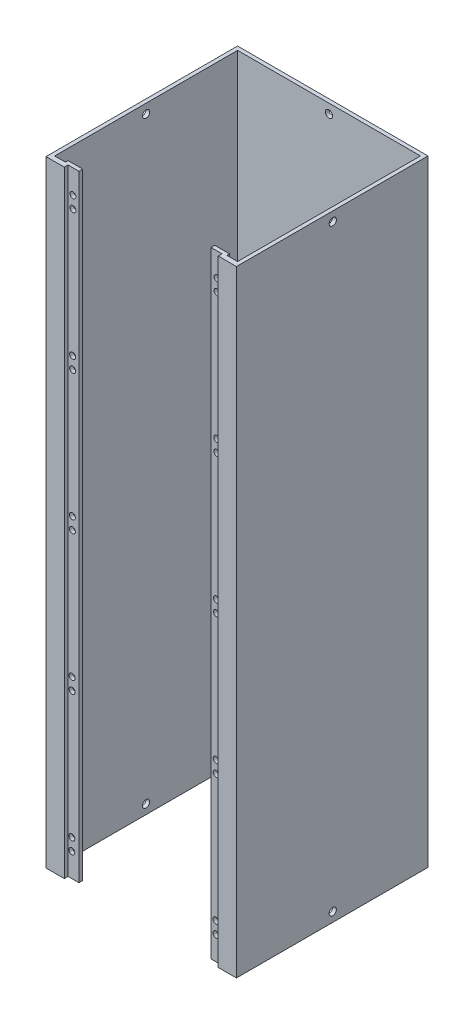
from build123d import *

# Parameters (mm, degrees)
BOSS_EXTRUDE1_DEPTH = 327.5
SKETCH2_R           = 1.6
CUT_EXTRUDE2_DEPTH  = 10
SKETCH3_R           = 1.93
CUT_EXTRUDE3_DEPTH  = 102
SKETCH4_R           = 1.93
CUT_EXTRUDE4_DEPTH  = 10


with BuildPart() as part:
    # Sketch1 → Boss-Extrude1 (new body)
    with BuildSketch(Plane(origin=(0, 0, 0), x_dir=(1, 0, 0), z_dir=(0, 1, 0))):
        Polygon((0, -0.603), (0, 101.206), (101.206, 101.206), (101.206, -0.6), (91.5, -0.6), (91.5, 1.4), (85.703, 1.4), (85.703, 3.4), (93.5, 3.4), (93.5, 2), (99.206, 2), (99.206, 99.206), (2, 99.206), (2, 2), (7.706, 2), (7.706, 3.397), (15.503, 3.397), (15.503, 1.397), (9.706, 1.397), (9.706, -0.603), align=None)
    extrude(amount=BOSS_EXTRUDE1_DEPTH)

    # Sketch2 → Cut-Extrude2 (cut)
    with BuildSketch(Plane.XY.offset(-1.397)):
        with Locations((12.303, 314.9)):
            Circle(SKETCH2_R)
        with Locations((12.303, 308.5)):
            Circle(SKETCH2_R)
        with Locations((88.903, 314.9)):
            Circle(SKETCH2_R)
        with Locations((88.903, 308.5)):
            Circle(SKETCH2_R)
        with Locations((12.15225, 240.925)):
            Circle(SKETCH2_R)
        with Locations((12.15225, 234.525)):
            Circle(SKETCH2_R)
        with Locations((88.75225, 240.925)):
            Circle(SKETCH2_R)
        with Locations((88.75225, 234.525)):
            Circle(SKETCH2_R)
        with Locations((12.0015, 166.95)):
            Circle(SKETCH2_R)
        with Locations((12.0015, 160.55)):
            Circle(SKETCH2_R)
        with Locations((88.6015, 166.95)):
            Circle(SKETCH2_R)
        with Locations((88.6015, 160.55)):
            Circle(SKETCH2_R)
        with Locations((11.85075, 92.975)):
            Circle(SKETCH2_R)
        with Locations((11.85075, 86.575)):
            Circle(SKETCH2_R)
        with Locations((88.45075, 92.975)):
            Circle(SKETCH2_R)
        with Locations((88.45075, 86.575)):
            Circle(SKETCH2_R)
        with Locations((11.7, 19)):
            Circle(SKETCH2_R)
        with Locations((11.7, 12.6)):
            Circle(SKETCH2_R)
        with Locations((88.3, 19)):
            Circle(SKETCH2_R)
        with Locations((88.3, 12.6)):
            Circle(SKETCH2_R)
    extrude(amount=-CUT_EXTRUDE2_DEPTH, mode=Mode.SUBTRACT)

    # Sketch3 → Cut-Extrude3 (cut)
    with BuildSketch(Plane(origin=(101.206, 0, 0), x_dir=(0, 0, -1), z_dir=(1, 0, 0))):
        with Locations((50.603, 322.524)):
            Circle(SKETCH3_R)
        with Locations((50.603, 4.976)):
            Circle(SKETCH3_R)
    extrude(amount=-CUT_EXTRUDE3_DEPTH, mode=Mode.SUBTRACT)

    # Sketch4 → Cut-Extrude4 (cut)
    with BuildSketch(Plane(origin=(0, 0, -101.206), x_dir=(-1, 0, 0), z_dir=(0, 0, -1))):
        with Locations((-50.603, 322.524)):
            Circle(SKETCH4_R)
        with Locations((-50.603, 4.976)):
            Circle(SKETCH4_R)
    extrude(amount=-CUT_EXTRUDE4_DEPTH, mode=Mode.SUBTRACT)


solid = part.part
